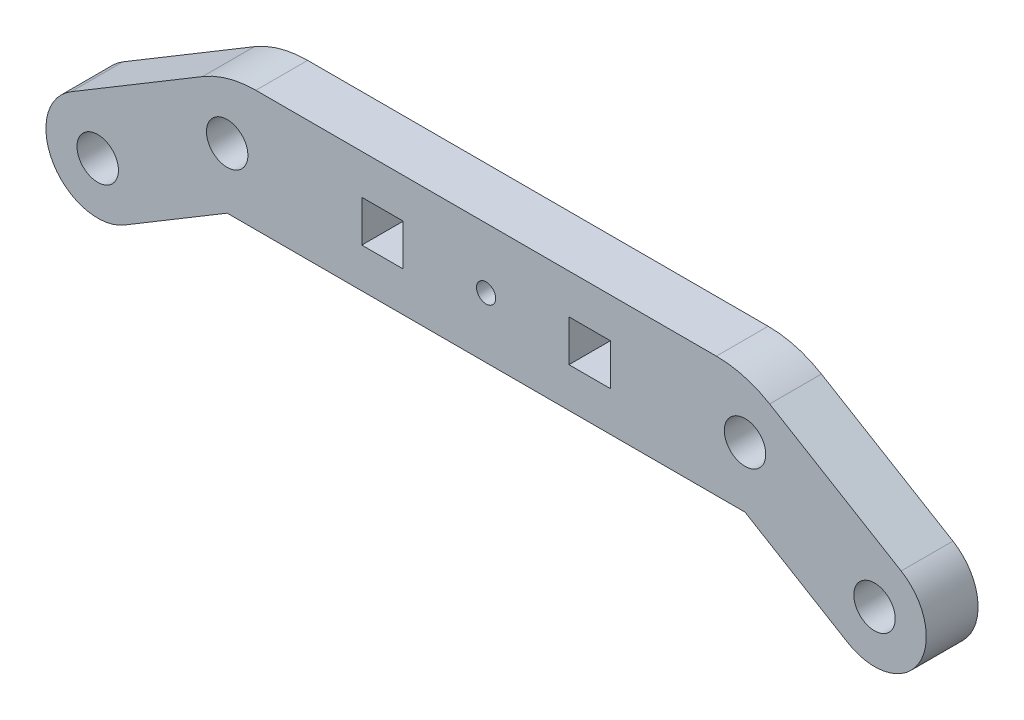
from build123d import *

# Parameters (mm, degrees)
ESBO_O1_R                = 4
ESBO_O1_R_2              = 1.85
ESBO_O1_W                = 8
ESBO_O1_H                = 8
RESSALTO_EXTRUS_O1_DEPTH = 10
FILETE1_R                = 20


with BuildPart() as part:
    # Esboço1 → Ressalto-extrusão1 (new body)
    with BuildSketch(Plane.XY):
        with BuildLine():
            Line((80.144957554, -18.086974533), (50, 0))
            Line((50, 0), (0, 0))
            Line((0, 0), (-50, 0))
            Line((-50, 0), (-80.144957554, -18.086974533))
            ThreePointArc((-80.144957554, -18.086974533), (-83.574929257, -31.806861344), (-69.855042446, -35.236833047))
            Line((-69.855042446, -35.236833047), (-50, -23.323807579))
            Line((-50, -23.323807579), (50, -23.323807579))
            Line((50, -23.323807579), (69.855042446, -35.236833047))
            ThreePointArc((69.855042446, -35.236833047), (83.574929257, -31.806861344), (80.144957554, -18.086974533))
        make_face()
        with Locations((-50, -11.66190379)):
            Circle(ESBO_O1_R, mode=Mode.SUBTRACT)
        with Locations(Location((50, -11.66190379, 0), (0, 0, 180))):
            Circle(ESBO_O1_R, mode=Mode.SUBTRACT)
        with Locations((0, -11.66190379)):
            Circle(ESBO_O1_R_2, mode=Mode.SUBTRACT)
        with Locations((-75, -26.66190379)):
            Circle(ESBO_O1_R, mode=Mode.SUBTRACT)
        with Locations(Location((75, -26.66190379, 0), (0, 0, 180))):
            Circle(ESBO_O1_R, mode=Mode.SUBTRACT)
        with Locations((20, -11.66190379)):
            Rectangle(ESBO_O1_W, ESBO_O1_H, mode=Mode.SUBTRACT)
        with Locations((-20, -11.66190379)):
            Rectangle(ESBO_O1_W, ESBO_O1_H, mode=Mode.SUBTRACT)
    extrude(amount=RESSALTO_EXTRUS_O1_DEPTH)

    # Filete1
    filete1_edges = [part.edges().sort_by_distance(p)[0] for p in [
        (-50, 0, 5),
        (50, 0, 5),
    ]]
    fillet(filete1_edges, radius=FILETE1_R)


solid = part.part
